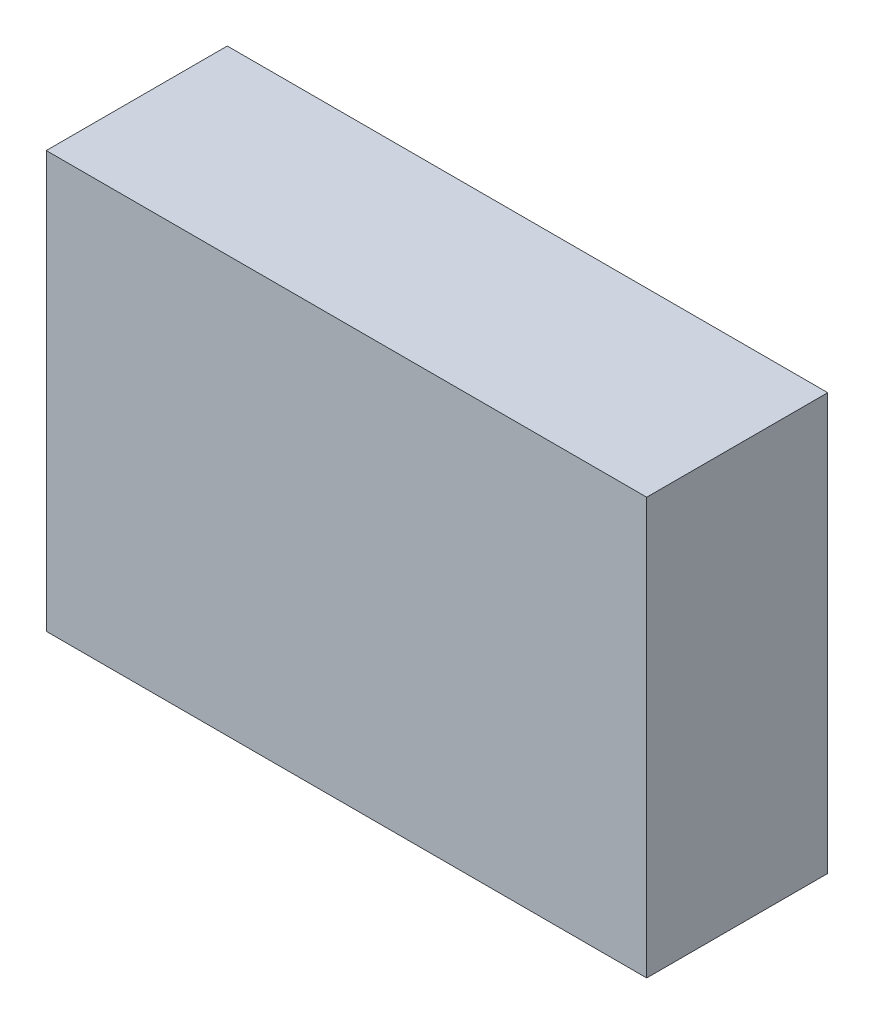
from build123d import *

# Parameters (mm, degrees)
SKETCH1_W               = 9.95
SKETCH1_H               = 6.9
COMPONENT_OUTLINE_DEPTH = 3


with BuildPart() as part:
    # Sketch1 → Component_Outline (new body)
    with BuildSketch(Plane.XY):
        with Locations((-0.275, 0.25)):
            Rectangle(SKETCH1_W, SKETCH1_H)
    extrude(amount=COMPONENT_OUTLINE_DEPTH)


solid = part.part
